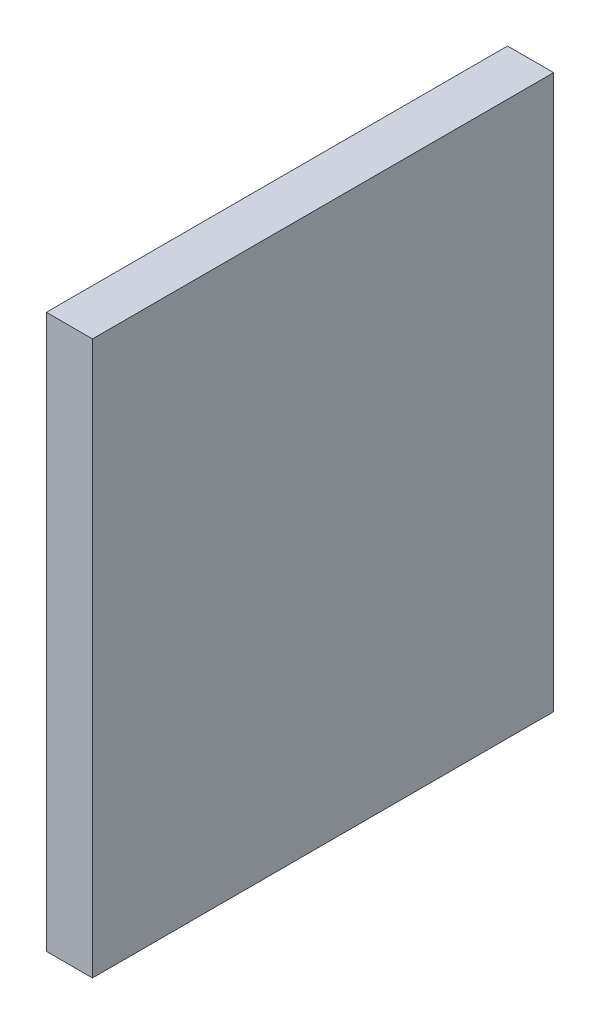
from build123d import *

# Parameters (mm, degrees)
EXTRUDE_1_DEPTH = 6


with BuildPart() as part:
    # Эскиз1 → Вытянуть1 (new body)
    with BuildSketch(Plane(origin=(0, 0, 0), x_dir=(0, 0, -1), z_dir=(1, 0, 0))):
        Polygon((-3e-09, -2), (59.999999874, -2), (59.999999875, -74.000000103), (-1.25e-07, -74), align=None)
    extrude(amount=EXTRUDE_1_DEPTH)


solid = part.part
